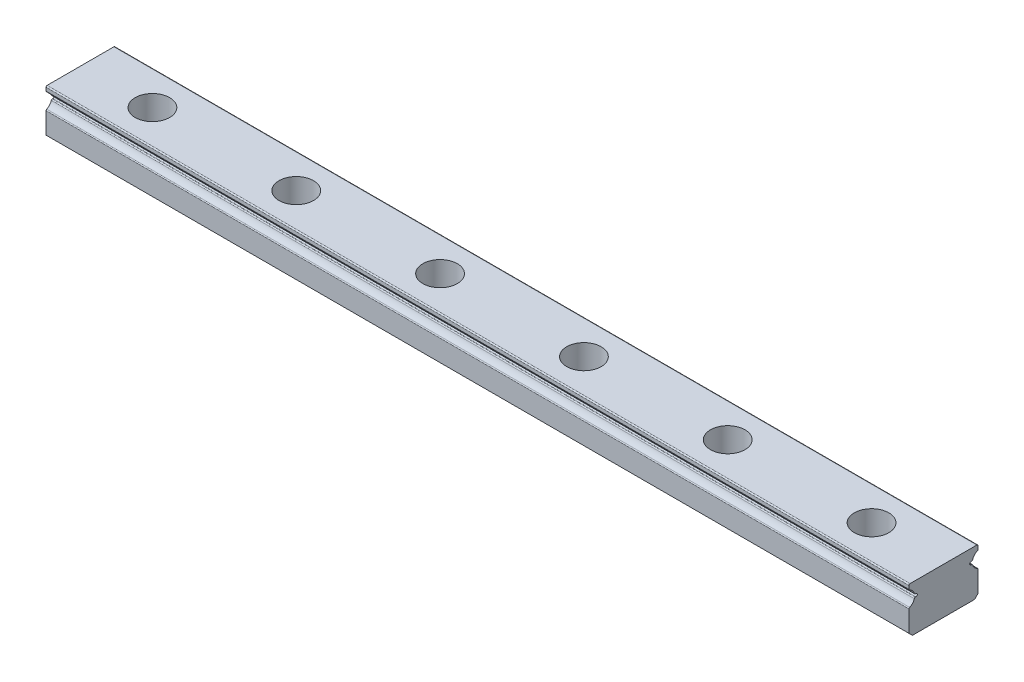
from build123d import *

# Parameters (mm, degrees)
SKETCH_1_W                   = 150
SKETCH_1_H                   = 12
EXTRUDE_1_DEPTH              = 8
CUT_EXTRUDE_1_DEPTH          = 151.173233301
CUT_EXTRUDE_2_DEPTH          = 151.173233301
CUT_EXTRUDE_3_DEPTH          = 151.173233301
CUT_EXTRUDE_4_DEPTH          = 151.173233301
CUT_EXTRUDE_5_DEPTH          = 151.173233301
CUT_EXTRUDE_6_DEPTH          = 151.173233301
HOLE_WIZARD_M3_1_D           = 3.5
HOLE_WIZARD_M3_1_CBORE_D     = 5.9999
HOLE_WIZARD_M3_1_CBORE_DEPTH = 4.5
CHAMFER_1_SIZE               = 0.6
FILLET_1_R                   = 0.2


with BuildPart() as part:
    # 草图1 → 凸台-拉伸1 (new body)
    with BuildSketch(Plane(origin=(0, 4, 0), x_dir=(1, 0, 0), z_dir=(0, 1, 0))):
        Rectangle(SKETCH_1_W, SKETCH_1_H)
    extrude(amount=-EXTRUDE_1_DEPTH)

    # 草图2 → 切除-拉伸1 (cut, through all)
    with BuildSketch(Plane(origin=(75, 0, 0), x_dir=(0, 0, -1), z_dir=(1, 0, 0))):
        with BuildLine():
            Line((6, 1.51), (6, 2.01))
            Line((6, 2.01), (4.8, 2.01))
            ThreePointArc((4.8, 2.01), (4.55, 1.76), (4.8, 1.51))
            Line((4.8, 1.51), (6, 1.51))
        make_face()
    extrude(amount=-CUT_EXTRUDE_1_DEPTH, mode=Mode.SUBTRACT)

    # 草图3 → 切除-拉伸2 (cut, through all)
    with BuildSketch(Plane(origin=(75, 0, 0), x_dir=(0, 0, -1), z_dir=(1, 0, 0))):
        with BuildLine():
            Line((6, 2.01), (6, 3.111111))
            ThreePointArc((6, 3.111111), (5.367595703, 2.693428684), (5.04, 2.01))
            Line((5.04, 2.01), (6, 2.01))
        make_face()
    extrude(amount=-CUT_EXTRUDE_2_DEPTH, mode=Mode.SUBTRACT)

    # 草图4 → 切除-拉伸3 (cut, through all)
    with BuildSketch(Plane(origin=(75, 0, 0), x_dir=(0, 0, -1), z_dir=(1, 0, 0))):
        with BuildLine():
            Line((6, 1.51), (5.04, 1.51))
            ThreePointArc((5.04, 1.51), (5.367595703, 0.826571316), (6, 0.408889))
            Line((6, 0.408889), (6, 1.51))
        make_face()
    extrude(amount=-CUT_EXTRUDE_3_DEPTH, mode=Mode.SUBTRACT)

    # 草图5 → 切除-拉伸4 (cut, through all)
    with BuildSketch(Plane(origin=(75, 0, 0), x_dir=(0, 0, -1), z_dir=(1, 0, 0))):
        with BuildLine():
            Line((-6, 2.01), (-6, 1.51))
            Line((-6, 1.51), (-4.8, 1.51))
            ThreePointArc((-4.8, 1.51), (-4.55, 1.76), (-4.8, 2.01))
            Line((-4.8, 2.01), (-6, 2.01))
        make_face()
    extrude(amount=-CUT_EXTRUDE_4_DEPTH, mode=Mode.SUBTRACT)

    # 草图6 → 切除-拉伸5 (cut, through all)
    with BuildSketch(Plane(origin=(75, 0, 0), x_dir=(0, 0, -1), z_dir=(1, 0, 0))):
        with BuildLine():
            Line((-6, 1.51), (-6, 0.408889))
            ThreePointArc((-6, 0.408889), (-5.367595703, 0.826571316), (-5.04, 1.51))
            Line((-5.04, 1.51), (-6, 1.51))
        make_face()
    extrude(amount=-CUT_EXTRUDE_5_DEPTH, mode=Mode.SUBTRACT)

    # 草图7 → 切除-拉伸6 (cut, through all)
    with BuildSketch(Plane(origin=(75, 0, 0), x_dir=(0, 0, -1), z_dir=(1, 0, 0))):
        with BuildLine():
            Line((-6, 2.01), (-5.04, 2.01))
            ThreePointArc((-5.04, 2.01), (-5.367595703, 2.693428684), (-6, 3.111111))
            Line((-6, 3.111111), (-6, 2.01))
        make_face()
    extrude(amount=-CUT_EXTRUDE_6_DEPTH, mode=Mode.SUBTRACT)

    # M3 六角头机械螺钉的柱形沉头孔1 (through all)
    with Locations(Plane(origin=(0, 4, 0), x_dir=(1, 0, 0), z_dir=(0, 1, 0))):
        with Locations((-62.5, 0), (-37.5, 0), (-12.5, 0), (12.5, 0), (37.5, 0), (62.5, 0)):
            CounterBoreHole(HOLE_WIZARD_M3_1_D / 2, HOLE_WIZARD_M3_1_CBORE_D / 2, HOLE_WIZARD_M3_1_CBORE_DEPTH)

    # 倒角1
    chamfer_1_edges = [part.edges().sort_by_distance(p)[0] for p in [
        (0, -4, -6),
        (0, -4, 6),
    ]]
    chamfer(chamfer_1_edges, length=CHAMFER_1_SIZE)

    # 圆角1
    fillet_1_edges = [part.edges().sort_by_distance(p)[0] for p in [
        (0, 2.01, -5.04),
        (0, 3.111111, -6),
        (0, 0.408889, -6),
        (0, 1.51, -5.04),
        (0, 4, -6),
        (0, 4, 6),
        (0, 1.51, 5.04),
        (0, 0.408889, 6),
        (0, 3.111111, 6),
        (0, 2.01, 5.04),
    ]]
    fillet(fillet_1_edges, radius=FILLET_1_R)


solid = part.part
